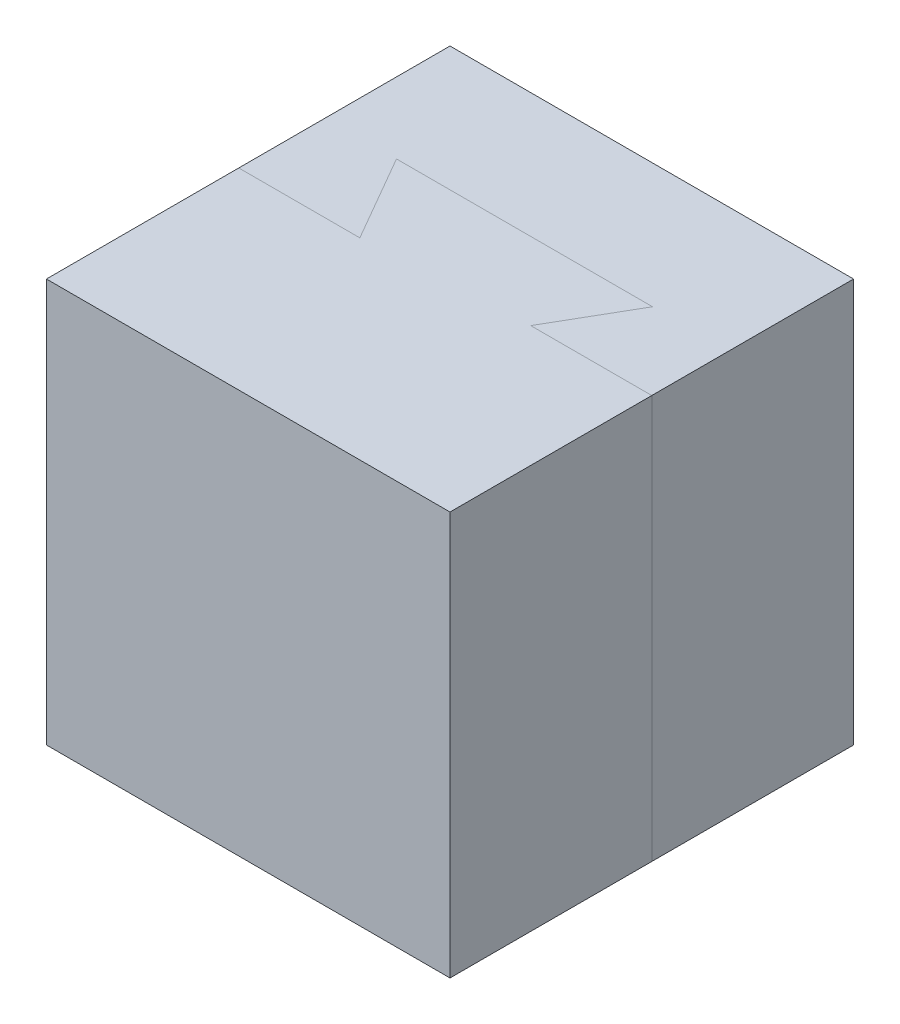
from build123d import *

# Parameters (mm, degrees)
SKETCH1_W              = 10
SKETCH1_H              = 10
BOSS_EXTRUDE1_DEPTH    = 10
SPLIT2_SURFACE_1_BACK  = 18.321
SPLIT2_SURFACE_1_DEPTH = 36.642
SPLIT2_SURFACE_2_BACK  = 18.321
SPLIT2_SURFACE_2_DEPTH = 36.642


with BuildPart() as part:
    # Sketch1 → Boss-Extrude1 (new body)
    with BuildSketch(Plane(origin=(0, 0, 0), x_dir=(1, 0, 0), z_dir=(0, 1, 0))):
        Rectangle(SKETCH1_W, SKETCH1_H)
    extrude(amount=BOSS_EXTRUDE1_DEPTH)


with BuildPart() as body_2:
    # Split2: the piece behind the surface
    add(part.part)
    # Split2 surface: a surface, the sketch's curves swept straight by 36.642 mm
    with BuildLine(Plane(origin=(0, 10, 0), x_dir=(1, 0, 0), z_dir=(0, 1, 0)).offset(-SPLIT2_SURFACE_1_BACK), mode=Mode.PRIVATE) as split2_surface_1_path:
        Line((-5, -0.234054964), (-2, -0.234054964))
        Line((-2, -0.234054964), (-3.239958467, 1.9136161))
        Line((-3.239958467, 1.9136161), (3.104826771, 1.9136161))
        Line((3.104826771, 1.9136161), (2, 0))
        Line((2, 0), (5, 0))
        Line((5, 0), (5, -5))
        Line((5, -5), (-5, -5))
        Line((-5, -5), (-5, -0.234054964))
    split2_surface_1 = Shell.extrude(split2_surface_1_path.wire(), (0 * SPLIT2_SURFACE_1_DEPTH, 1 * SPLIT2_SURFACE_1_DEPTH, 0 * SPLIT2_SURFACE_1_DEPTH))
    split(bisect_by=split2_surface_1, keep=Keep.BOTTOM)


with BuildPart() as part_1:
    add(part.part)

    # Split2: split by a surface, the side it looks to stays
    # Split2 surface: a surface, the sketch's curves swept straight by 36.642 mm
    with BuildLine(Plane(origin=(0, 10, 0), x_dir=(1, 0, 0), z_dir=(0, 1, 0)).offset(-SPLIT2_SURFACE_2_BACK), mode=Mode.PRIVATE) as split2_surface_2_path:
        Line((-5, -0.234054964), (-2, -0.234054964))
        Line((-2, -0.234054964), (-3.239958467, 1.9136161))
        Line((-3.239958467, 1.9136161), (3.104826771, 1.9136161))
        Line((3.104826771, 1.9136161), (2, 0))
        Line((2, 0), (5, 0))
        Line((5, 0), (5, -5))
        Line((5, -5), (-5, -5))
        Line((-5, -5), (-5, -0.234054964))
    split2_surface_2 = Shell.extrude(split2_surface_2_path.wire(), (0 * SPLIT2_SURFACE_2_DEPTH, 1 * SPLIT2_SURFACE_2_DEPTH, 0 * SPLIT2_SURFACE_2_DEPTH))
    split(bisect_by=split2_surface_2, keep=Keep.TOP)


solid = Compound([body_2.part, part_1.part])
